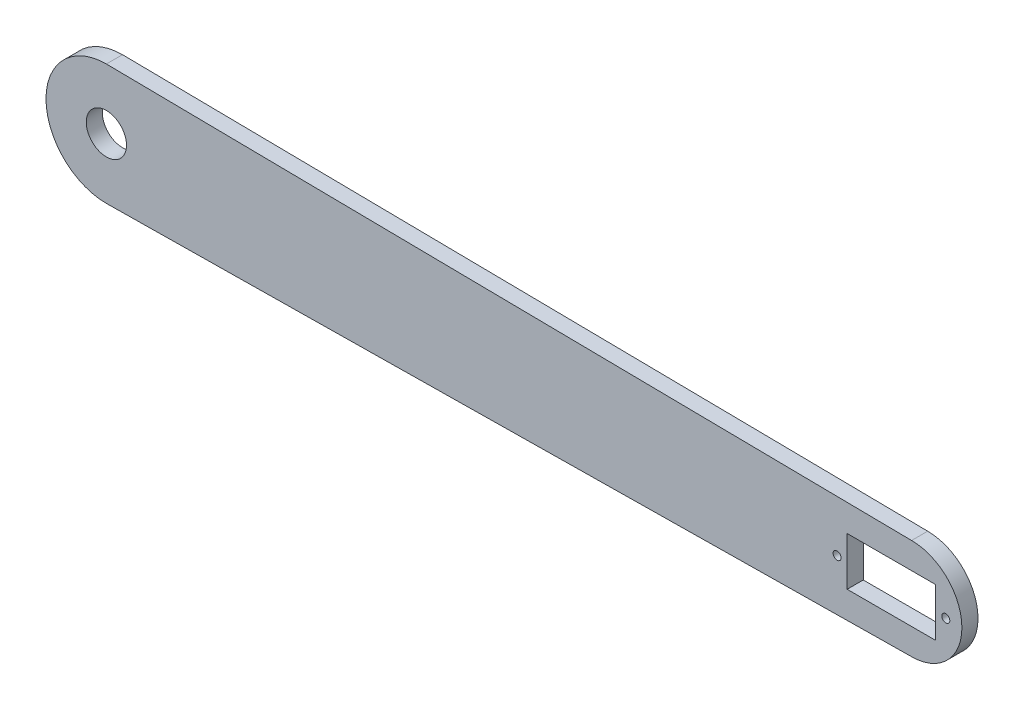
from build123d import *

# Parameters (mm, degrees)
SKETCH1_R           = 5
SKETCH1_R_2         = 1
SKETCH1_W           = 22
SKETCH1_H           = 12
BOSS_EXTRUDE1_DEPTH = 4


with BuildPart() as part:
    # Sketch1 → Boss-Extrude1 (new body)
    with BuildSketch(Plane.XY):
        with BuildLine():
            Line((200, 12.5), (0, 15))
            ThreePointArc((0, 15), (-15, 0), (0, -15))
            Line((0, -15), (200, -12.5))
            ThreePointArc((200, -12.5), (212.5, 0), (200, 12.5))
        make_face()
        Circle(SKETCH1_R, mode=Mode.SUBTRACT)
        with Locations((181.5, 0)):
            Circle(SKETCH1_R_2, mode=Mode.SUBTRACT)
        with Locations((195, 0)):
            Rectangle(SKETCH1_W, SKETCH1_H, mode=Mode.SUBTRACT)
        with Locations((208.5, 0)):
            Circle(SKETCH1_R_2, mode=Mode.SUBTRACT)
    extrude(amount=BOSS_EXTRUDE1_DEPTH)


solid = part.part
